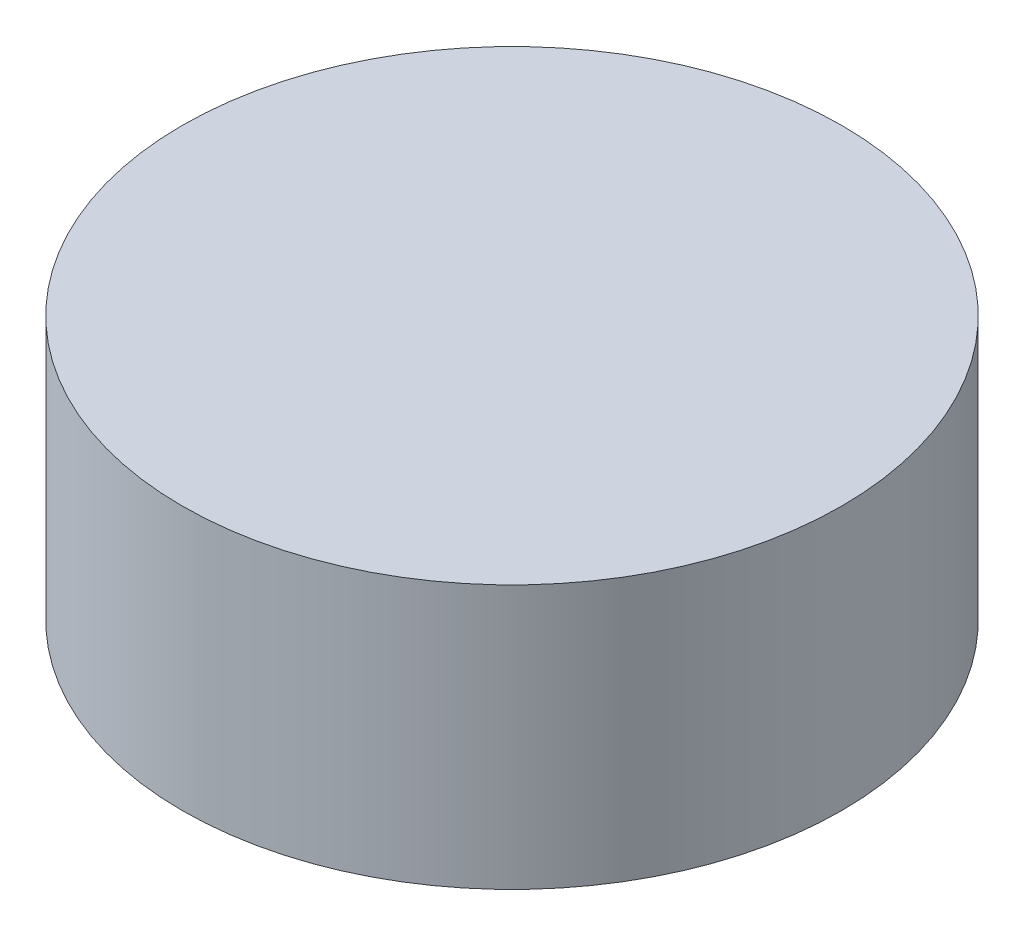
from build123d import *

# Parameters (mm, degrees)
SKETCH1_R           = 7.9375
BOSS_EXTRUDE1_DEPTH = 6.35


with BuildPart() as part:
    # Sketch1 → Boss-Extrude1 (new body)
    with BuildSketch(Plane(origin=(0, 0, 0), x_dir=(1, 0, 0), z_dir=(0, 1, 0))):
        with Locations(Location((0, 0, 0), (0, 0, 270))):
            Circle(SKETCH1_R)
    extrude(amount=BOSS_EXTRUDE1_DEPTH)


solid = part.part
